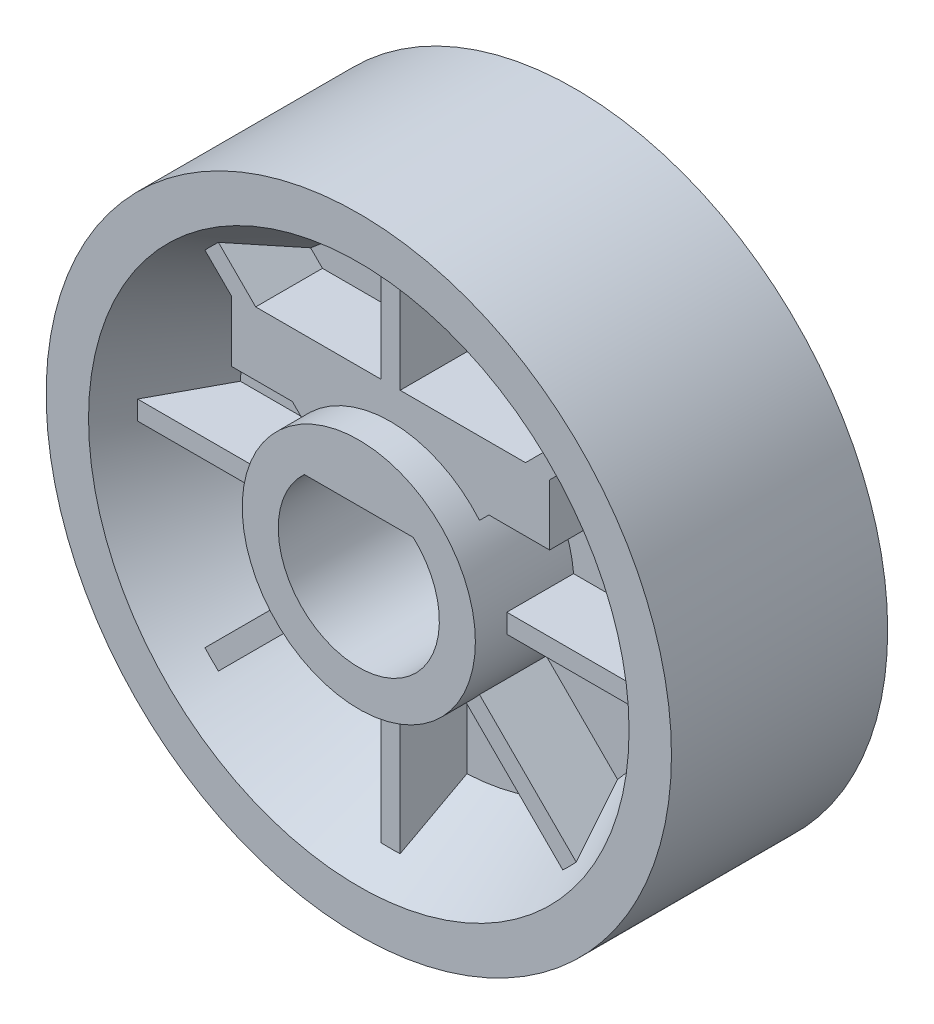
from build123d import *

# Parameters (mm, degrees)
SKETCH_2_R          = 5
CUT_EXTRUDE_1_DEPTH = 47.439853574
SKETCH_3_W          = 1.8
SKETCH_3_H          = 18
SKETCH_3_W_2        = 18
SKETCH_3_H_2        = 1.8
EXTRUDE_1_DEPTH     = 15
SKETCH_4_W          = 30
SKETCH_4_H          = 6
EXTRUDE_2_DEPTH     = 15
SCALE_1_SCALE       = 1.01


with BuildPart() as part:
    # Эскиз1 → Повернуть1 (revolve)
    with BuildSketch(Plane(origin=(0, 0, 0), x_dir=(1, 0, 0), z_dir=(0, 1, 0)), mode=Mode.PRIVATE) as revolve_1_sk:
        Polygon((-5, 0), (-11, 0), (-11, 9.3), (-20.5, 9.3), (-25.5, 0), (-29.5, 0), (-29.5, 20.4), (-25.5, 20.4), (-20.5, 11.1), (-11, 11.1), (-11, 20.4), (-5, 20.4), align=None)
    revolve(revolve_1_sk.sketch.rotate(Axis((0, 0, 0), (0, 0, -1)), 180), axis=Axis((0, 0, 0), (0, 0, -1)))

    # Эскиз2 → Вырез-Вытянуть1 (cut, through all)
    with BuildSketch(Plane.XY):
        with BuildLine():
            Line((5.138093031, 5.6), (-5.138093031, 5.6))
            ThreePointArc((-5.138093031, 5.6), (-3.058634741, -6.957352479), (7.6, 0))
            ThreePointArc((7.6, 0), (6.957352479, 3.058634741), (5.138093031, 5.6))
        make_face()
        Circle(SKETCH_2_R, mode=Mode.SUBTRACT)
    extrude(amount=-CUT_EXTRUDE_1_DEPTH, mode=Mode.SUBTRACT)

    # Эскиз3 → Бобышка-Вытянуть1 (add)
    with BuildSketch(Plane.XY.offset(-3)):
        Polygon((5.020458146, 6.293250353), (6.293250353, 5.020458146), (19.021172414, 17.748380208), (17.748380208, 19.021172414), align=None)
        with Locations((0, 17)):
            Rectangle(SKETCH_3_W, SKETCH_3_H)
        with Locations((17, 0)):
            Rectangle(SKETCH_3_W_2, SKETCH_3_H_2)
        Polygon((6.293250353, -5.020458146), (5.020458146, -6.293250353), (17.748380208, -19.021172414), (19.021172414, -17.748380208), align=None)
        with Locations((0, -17)):
            Rectangle(SKETCH_3_W, SKETCH_3_H)
        Polygon((-5.020458146, -6.293250353), (-6.293250353, -5.020458146), (-19.021172414, -17.748380208), (-17.748380208, -19.021172414), align=None)
        with Locations((-17, 0)):
            Rectangle(SKETCH_3_W_2, SKETCH_3_H_2)
        Polygon((-6.293250353, 5.020458146), (-5.020458146, 6.293250353), (-17.748380208, 19.021172414), (-19.021172414, 17.748380208), align=None)
    extrude(amount=-EXTRUDE_1_DEPTH)

    # Эскиз4 → Бобышка-Вытянуть2 (add)
    with BuildSketch(Plane.XY.offset(-3)):
        with Locations((0, 11)):
            Rectangle(SKETCH_4_W, SKETCH_4_H)
    extrude(amount=-EXTRUDE_2_DEPTH)


with BuildPart() as part_1:
    # Масштаб1: scaled about (0, 0.590334884, -10.24232435)
    add(part.part.scale(SCALE_1_SCALE).moved(Location((0, -0.005903349, 0.102423244))))


solid = part_1.part
